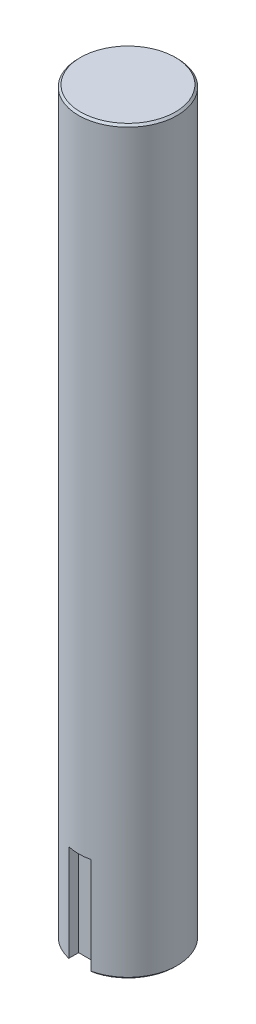
from build123d import *

# Parameters (mm, degrees)
SKETCH1_W          = 5
SKETCH1_H          = 75
SKETCH2_W          = 2.25
SKETCH2_H          = 2.25
CUT_EXTRUDE1_DEPTH = 10
CHAMFER1_SIZE      = 0.2


with BuildPart() as part:
    # Sketch1 → Revolve1 (revolve)
    with BuildSketch(Plane.XY, mode=Mode.PRIVATE) as revolve1_sk:
        with Locations((2.5, 37.5)):
            Rectangle(SKETCH1_W, SKETCH1_H)
    revolve(revolve1_sk.sketch.rotate(Axis((0, 75, 0), (0, -1, 0)), 180), axis=Axis((0, 75, 0), (0, -1, 0)))

    # Sketch2 → Cut-Extrude1 (cut)
    with BuildSketch(Plane.XZ):
        with Locations((0, 5)):
            Rectangle(SKETCH2_W, SKETCH2_H)
    extrude(amount=-CUT_EXTRUDE1_DEPTH, mode=Mode.SUBTRACT)

    # Chamfer1
    chamfer1_edges = [part.edges().sort_by_distance(p)[0] for p in [
        (1.125, 0, 4.373396909),
        (0, 0, 3.875),
        (5, 75, 0),
        (3.112474899, 0, -3.913118961),
        (-1.125, 0, 4.373396909),
    ]]
    chamfer(chamfer1_edges, length=CHAMFER1_SIZE)


solid = part.part
